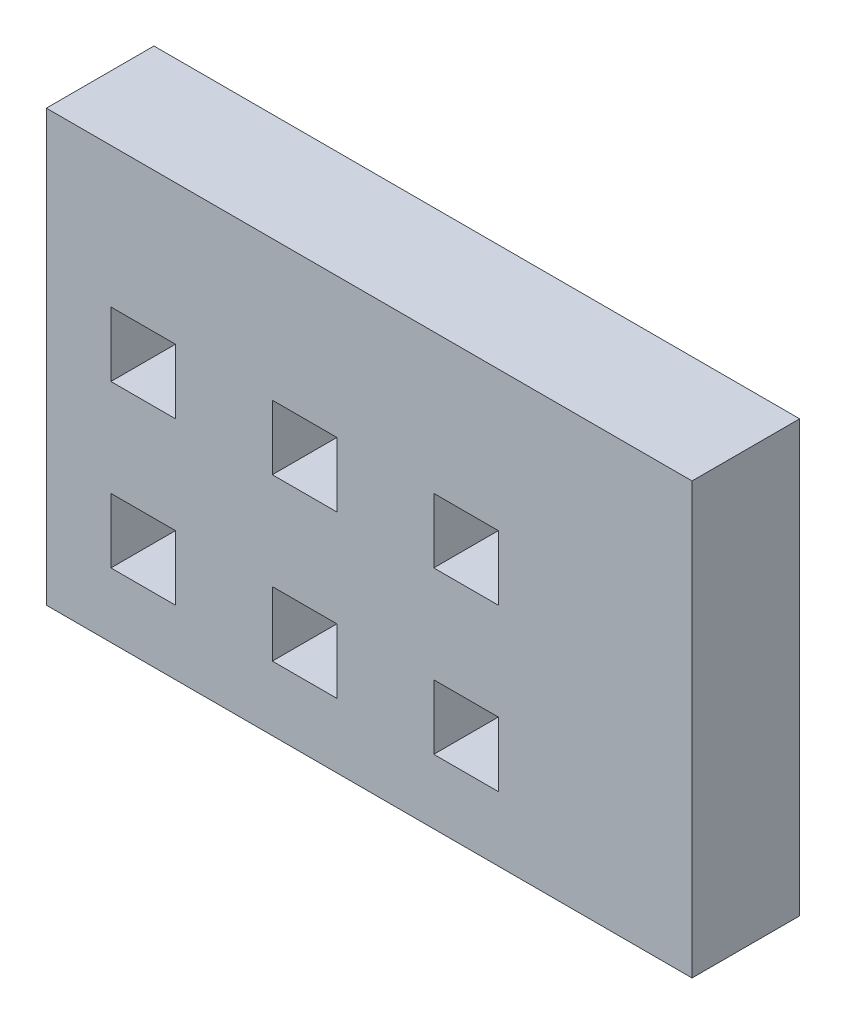
from build123d import *

# Parameters (mm, degrees)
SKETCH1_W            = 60
SKETCH1_H            = 40
BOSS_EXTRUDE1_DEPTH  = 10
SKETCH2_W            = 6
SKETCH2_H            = 6
CUT_EXTRUDE1_DEPTH   = 73.801098893
LPATTERN1_COUNT      = 3
LPATTERN1_PITCH      = 15
LPATTERN1_COUNT_DIR2 = 2
LPATTERN1_PITCH_DIR2 = 15


with BuildPart() as part:
    # Sketch1 → Boss-Extrude1 (new body)
    with BuildSketch(Plane.XY):
        with Locations((30, 20)):
            Rectangle(SKETCH1_W, SKETCH1_H)
    extrude(amount=BOSS_EXTRUDE1_DEPTH)

    # Sketch2 → Cut-Extrude1 (cut, through all)
    with BuildSketch(Plane.XY):
        with Locations((9, 9)):
            Rectangle(SKETCH2_W, SKETCH2_H)
    cut_extrude1 = extrude(amount=CUT_EXTRUDE1_DEPTH, mode=Mode.SUBTRACT)

    # LPattern1: Cut-Extrude1 3 × 2
    with Locations(*[(i * LPATTERN1_PITCH, j * LPATTERN1_PITCH_DIR2, 0) for i in range(LPATTERN1_COUNT) for j in range(LPATTERN1_COUNT_DIR2) if (i, j) != (0, 0)]):
        add(cut_extrude1, mode=Mode.SUBTRACT)


solid = part.part
